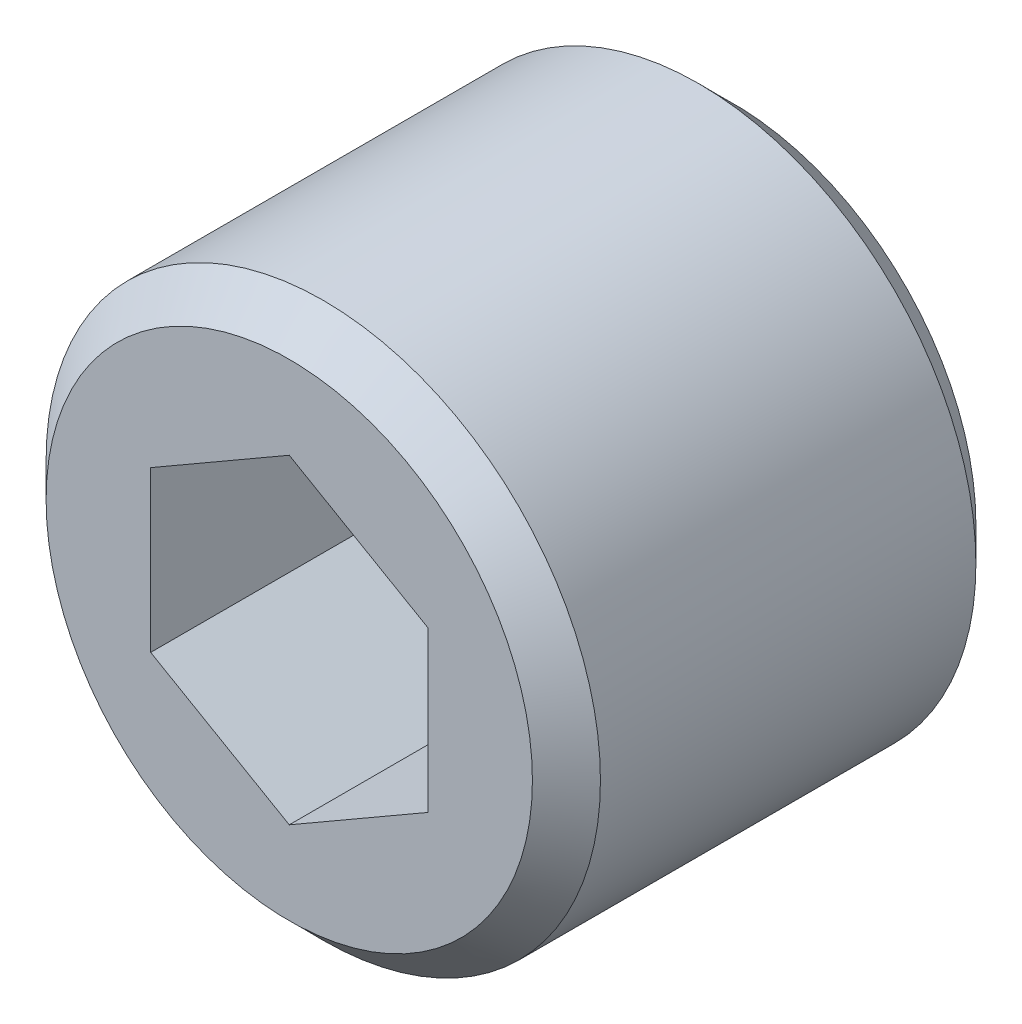
from build123d import *

# Parameters (mm, degrees)
SZKIC3_R                    = 3.586751346
DODANIE_WYCI_GNI_CIE1_DEPTH = 6


with BuildPart() as part:
    # Szkic1 → Obrót1 (revolve)
    with BuildSketch(Plane(origin=(0, 0, 0), x_dir=(0, 0, -1), z_dir=(1, 0, 0)), mode=Mode.PRIVATE) as obr_t1_sk:
        Polygon((-8, 0), (-8, 4.3865), (-7.3865, 5), (-0.6135, 5), (0, 4.3865), (0, 0), align=None)
    revolve(obr_t1_sk.sketch.rotate(Axis((0, 0, 0), (0, 0, 1)), 270), axis=Axis((0, 0, 0), (0, 0, 1)))

    # Szkic2 → Wycięcie-obrót1 (revolve, cut)
    with BuildSketch(Plane(origin=(0, 0, 0), x_dir=(0, 0, -1), z_dir=(1, 0, 0)), mode=Mode.PRIVATE) as wyci_cie_obr_t1_sk:
        Polygon((-8, 0), (-8, 3.386751346), (-4, 3.386751346), (-2.044658199, 0), align=None)
    revolve(wyci_cie_obr_t1_sk.sketch.rotate(Axis((0, 0, 2.044658199), (0, 0, 1)), 270), axis=Axis((0, 0, 2.044658199), (0, 0, 1)), mode=Mode.SUBTRACT)

    # Szkic3 → Dodanie-wyciągnięcie1 (add)
    with BuildSketch(Plane.XY.offset(8)):
        Circle(SZKIC3_R)
        Polygon((-2.5, 1.443375673), (-2.5, -1.443375673), (0, -2.886751346), (2.5, -1.443375673), (2.5, 1.443375673), (0, 2.886751346), align=None, mode=Mode.SUBTRACT)
    extrude(amount=-DODANIE_WYCI_GNI_CIE1_DEPTH)


solid = part.part
